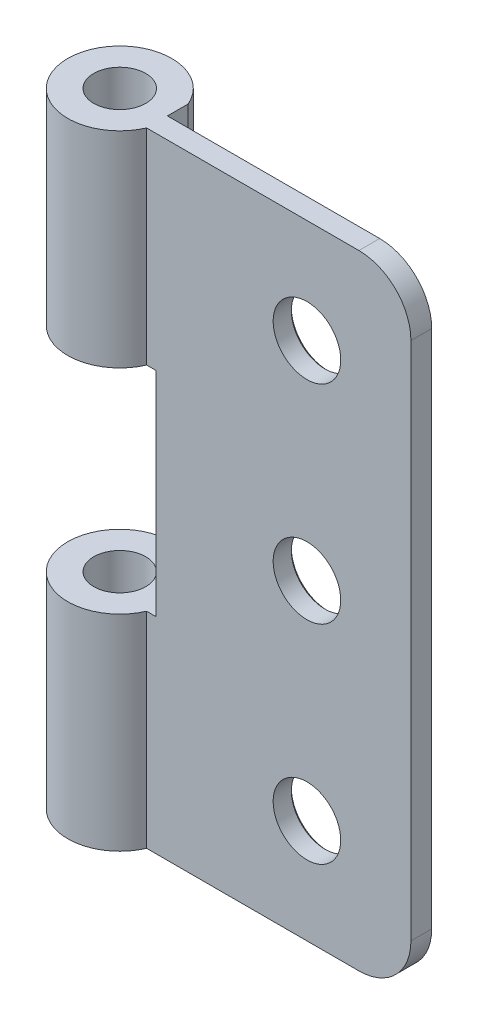
from build123d import *

# Parameters (mm, degrees)
SKETCH1_R                            = 2.5
BOSS_EXTRUDE1_DEPTH                  = 30
SKETCH1_3_R                          = 2.5
CUT_EXTRUDE1_DEPTH                   = 10.25
F_6_5_6_5_DIAMETER_HOLE1_D           = 6.5
F_6_5_6_5_DIAMETER_HOLE1_CSINK_D     = 7
F_6_5_6_5_DIAMETER_HOLE1_CSINK_ANGLE = 90
FILLET1_R                            = 5


with BuildPart() as part:
    # Sketch1 → Boss-Extrude1 (new, symmetric)
    with BuildSketch(Plane(origin=(0, 0, 0), x_dir=(1, 0, 0), z_dir=(0, 1, 0))):
        with BuildLine():
            Line((4.582575695, 0), (4.582575695, 2))
            ThreePointArc((4.582575695, 2), (-5, 0), (4.582575695, -2))
            Line((4.582575695, -2), (30, -2))
            Line((30, -2), (30, 0))
            Line((30, 0), (4.582575695, 0))
        make_face()
        Circle(SKETCH1_R, mode=Mode.SUBTRACT)
    extrude(amount=BOSS_EXTRUDE1_DEPTH, both=True)

    # Sketch1<3> → Cut-Extrude1 (cut, symmetric)
    with BuildSketch(Plane(origin=(0, 0, 0), x_dir=(1, 0, 0), z_dir=(0, 1, 0))):
        with BuildLine():
            Line((4.582575695, -2), (5.5, -2))
            Line((5.5, -2), (5.5, 0))
            Line((5.5, 0), (4.582575695, 0))
            Line((4.582575695, 0), (4.582575695, 2))
            ThreePointArc((4.582575695, 2), (-5, 0), (4.582575695, -2))
        make_face()
        Circle(SKETCH1_3_R, mode=Mode.SUBTRACT)
    extrude(amount=CUT_EXTRUDE1_DEPTH, both=True, mode=Mode.SUBTRACT)

    # Ø6.5 (6.5) Diameter Hole1 (through all)
    with Locations(Plane(origin=(0, 0, 0), x_dir=(-1, 0, 0), z_dir=(0, 0, -1))):
        with Locations((-20, -20), (-20, 0), (-20, 20)):
            CounterSinkHole(F_6_5_6_5_DIAMETER_HOLE1_D / 2, F_6_5_6_5_DIAMETER_HOLE1_CSINK_D / 2, counter_sink_angle=F_6_5_6_5_DIAMETER_HOLE1_CSINK_ANGLE)

    # Fillet1
    fillet1_edges = [part.edges().sort_by_distance(p)[0] for p in [
        (30, 30, 1),
        (30, -30, 1),
    ]]
    fillet(fillet1_edges, radius=FILLET1_R)


solid = part.part
